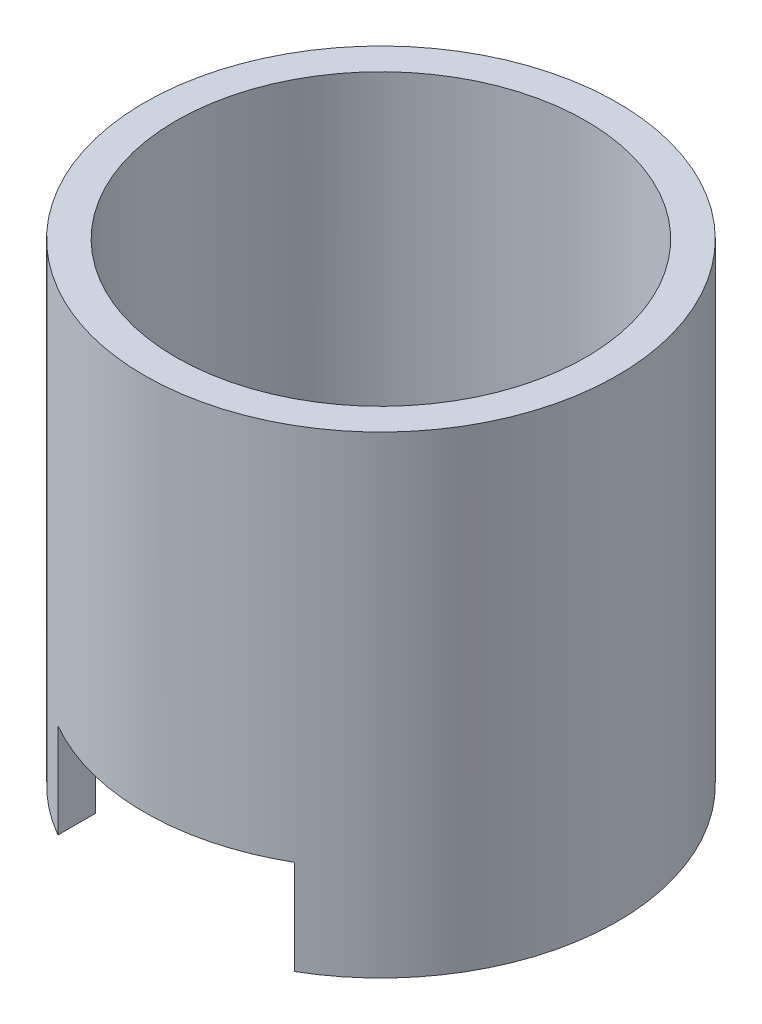
from build123d import *

# Parameters (mm, degrees)
IZIM1_R                     = 150
IZIM1_R_2                   = 130
Y_KSEKLIK_EKSTR_ZYON1_DEPTH = 300
IZIM2_W                     = 75
IZIM2_H                     = 60
KES_EKSTR_ZYON1_DEPTH       = 180


with BuildPart() as part:
    # Çizim1 → Yükseklik-Ekstrüzyon1 (new body)
    with BuildSketch(Plane(origin=(0, 0, 0), x_dir=(1, 0, 0), z_dir=(0, 1, 0))):
        with Locations(Location((0, 0, 0), (0, 0, 270))):
            Circle(IZIM1_R)
        with Locations(Location((0, 0, 0), (0, 0, 270))):
            Circle(IZIM1_R_2, mode=Mode.SUBTRACT)
    extrude(amount=Y_KSEKLIK_EKSTR_ZYON1_DEPTH)

    # Çizim2 → Kes-Ekstrüzyon1 (cut)
    with BuildSketch(Plane.XY):
        with Locations((-37.5, 30)):
            Rectangle(IZIM2_W, IZIM2_H)
        with Locations((37.5, 30)):
            Rectangle(IZIM2_W, IZIM2_H)
    extrude(amount=KES_EKSTR_ZYON1_DEPTH, mode=Mode.SUBTRACT)


solid = part.part
